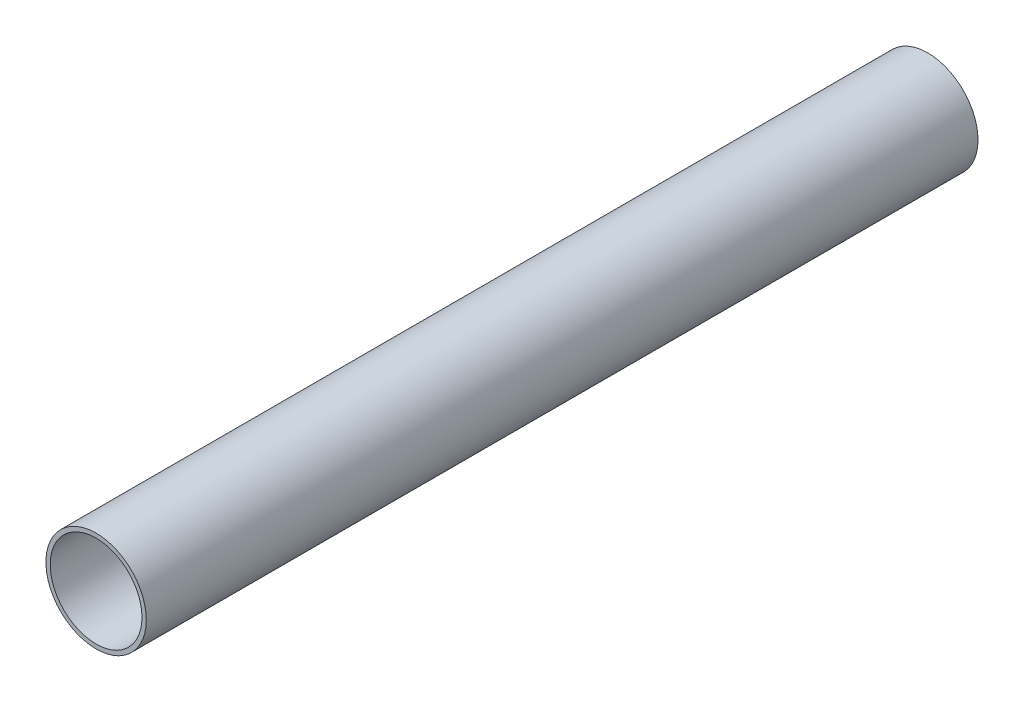
from build123d import *

# Parameters (mm, degrees)
SKETCH_1_R      = 17.5
SKETCH_1_R_2    = 16
EXTRUDE_1_DEPTH = 290


with BuildPart() as part:
    # 스케치1 → 보스-돌출1 (new body)
    with BuildSketch(Plane.XY):
        Circle(SKETCH_1_R)
        Circle(SKETCH_1_R_2, mode=Mode.SUBTRACT)
    extrude(amount=EXTRUDE_1_DEPTH)


solid = part.part
